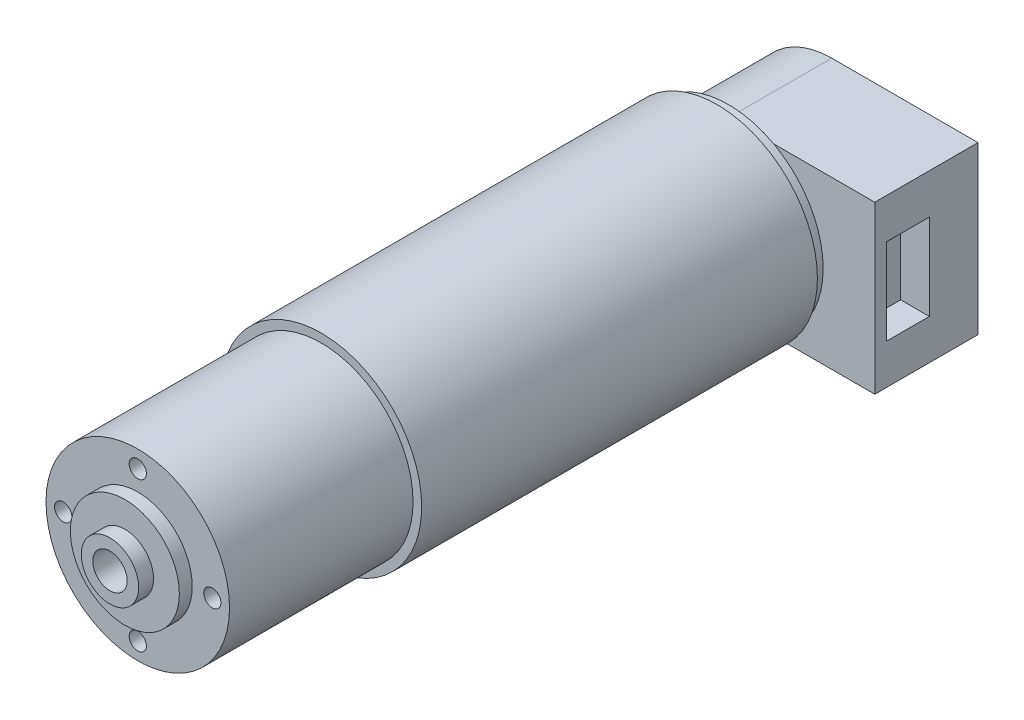
from build123d import *

# Parameters (mm, degrees)
SKETCH_1_R               = 17.5
EXTRUDE_1_DEPTH          = 69
SKETCH_2_R               = 16
EXTRUDE_2_DEPTH          = 26
SKETCH_3_R               = 16
EXTRUDE_3_DEPTH          = 6
SKETCH_4_R               = 9.5
EXTRUDE_4_DEPTH          = 2.25
SKETCH_5_R               = 5
EXTRUDE_5_DEPTH          = 2.6
SKETCH_8_R               = 16.5
EXTRUDE_7_DEPTH          = 2
EXTRUDE_8_DEPTH          = 18
SKETCH_10_W              = 7.5
SKETCH_10_H              = 15
CUT_EXTRUDE_2_DEPTH      = 5
SKETCH_7_R               = 1.5
CUT_EXTRUDE_1_DEPTH      = 3.8
PATTERN_CIRCULAR_1_COUNT = 4
SKETCH_6_R               = 3
CUT_EXTRUDE_3_DEPTH      = 10


with BuildPart() as part:
    # 스케치1 → 보스-돌출1 (new body)
    with BuildSketch(Plane.XY):
        Circle(SKETCH_1_R)
    extrude(amount=EXTRUDE_1_DEPTH)

    # 스케치2 → 보스-돌출2 (add)
    with BuildSketch(Plane.XY.offset(69)):
        with Locations(Location((0, 0, 0), (0, 0, 180))):
            Circle(SKETCH_2_R)
    extrude(amount=EXTRUDE_2_DEPTH)

    # 스케치3 → 보스-돌출3 (add)
    with BuildSketch(Plane.XY.offset(95)):
        with Locations(Location((0, 0, 0), (0, 0, 180))):
            Circle(SKETCH_3_R)
    extrude(amount=EXTRUDE_3_DEPTH)

    # 스케치4 → 보스-돌출4 (add)
    with BuildSketch(Plane.XY.offset(101)):
        Circle(SKETCH_4_R)
    extrude(amount=EXTRUDE_4_DEPTH)

    # 스케치5 → 보스-돌출5 (add)
    with BuildSketch(Plane.XY.offset(103.25)):
        Circle(SKETCH_5_R)
    extrude(amount=EXTRUDE_5_DEPTH)

    # 스케치8 → 보스-돌출7 (add)
    with BuildSketch(Plane(origin=(0, 0, 0), x_dir=(-1, 0, 0), z_dir=(0, 0, -1))):
        with Locations(Location((0, 0, 0), (0, 0, 180))):
            Circle(SKETCH_8_R)
    extrude(amount=EXTRUDE_7_DEPTH)

    # 스케치9 → 보스-돌출8 (add)
    with BuildSketch(Plane(origin=(0, 0, -2), x_dir=(-1, 0, 0), z_dir=(0, 0, -1))):
        with BuildLine():
            Line((0, 14.5), (-25.5, 14.5))
            Line((-25.5, 14.5), (-25.5, -14.5))
            Line((-25.5, -14.5), (0, -14.5))
            ThreePointArc((0, -14.5), (14.5, 0), (0, 14.5))
        make_face()
    extrude(amount=EXTRUDE_8_DEPTH)

    # 스케치10 → 컷-돌출2 (cut)
    with BuildSketch(Plane(origin=(25.5, 0, 0), x_dir=(0, 0, -1), z_dir=(1, 0, 0))):
        with Locations((7.760897897, 0)):
            Rectangle(SKETCH_10_W, SKETCH_10_H)
    extrude(amount=-CUT_EXTRUDE_2_DEPTH, mode=Mode.SUBTRACT)

    # 스케치7 → 컷-돌출1 (cut)
    with BuildSketch(Plane.XY.offset(101)):
        with Locations((0, 13)):
            Circle(SKETCH_7_R)
    cut_extrude_1 = extrude(amount=-CUT_EXTRUDE_1_DEPTH, mode=Mode.SUBTRACT)

    # 원형 패턴1: 컷-돌출1 ×4 about axis
    pattern_circular_1_axis = Axis((0, 0, 0), (0, 0, 1))
    for i in range(1, PATTERN_CIRCULAR_1_COUNT):
        add(cut_extrude_1.rotate(pattern_circular_1_axis, i * 360 / PATTERN_CIRCULAR_1_COUNT), mode=Mode.SUBTRACT)

    # 스케치6 → 컷-돌출3 (cut)
    with BuildSketch(Plane.XY.offset(105.85)):
        Circle(SKETCH_6_R)
    extrude(amount=-CUT_EXTRUDE_3_DEPTH, mode=Mode.SUBTRACT)


solid = part.part
